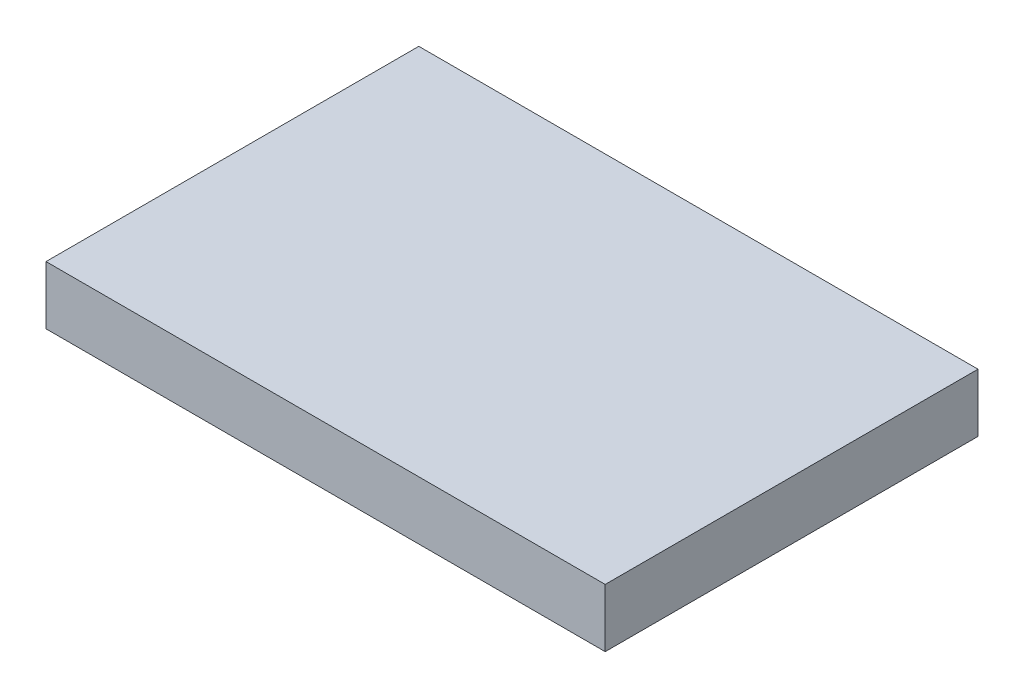
from build123d import *

# Parameters (mm, degrees)
SKETCH1_W           = 12
SKETCH1_H           = 8
BOSS_EXTRUDE1_DEPTH = 1.25


with BuildPart() as part:
    # Sketch1 → Boss-Extrude1 (new body)
    with BuildSketch(Plane(origin=(0, 0, 0), x_dir=(1, 0, 0), z_dir=(0, 1, 0))):
        with Locations((6, 4)):
            Rectangle(SKETCH1_W, SKETCH1_H)
    extrude(amount=BOSS_EXTRUDE1_DEPTH)


solid = part.part
